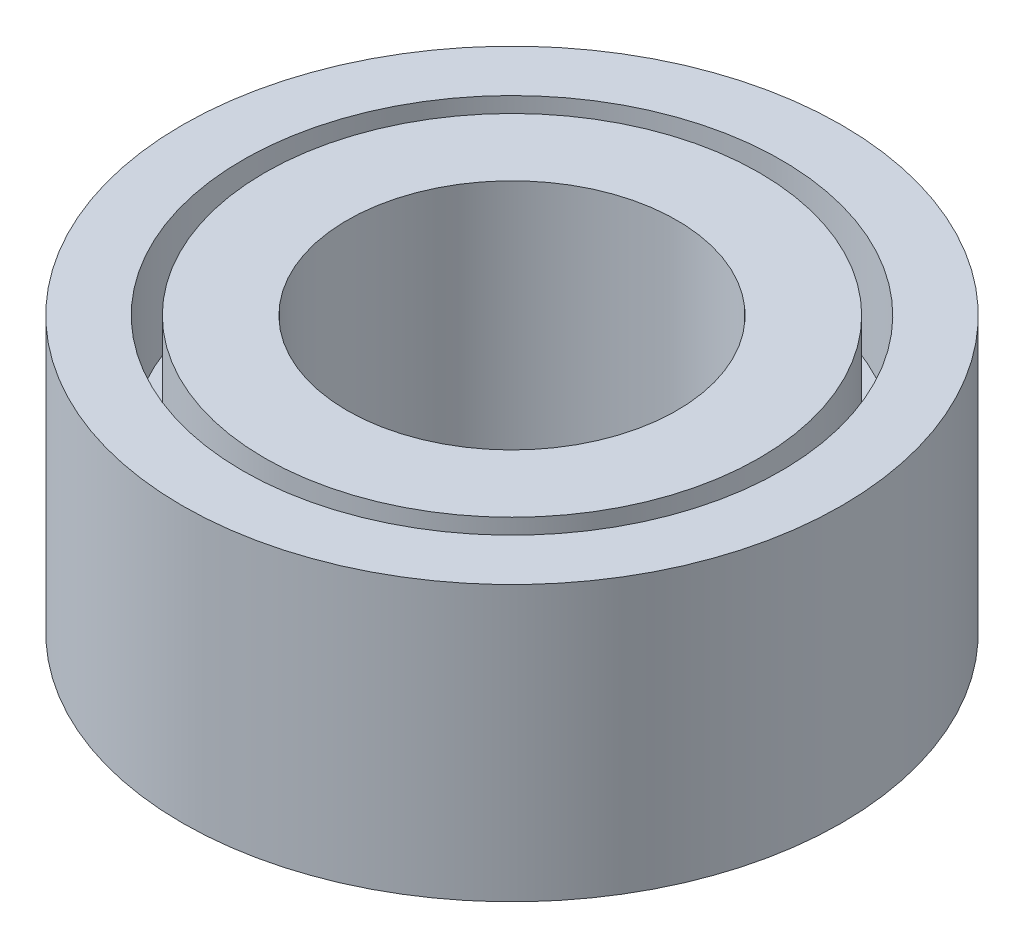
from build123d import *

# Parameters (mm, degrees)
SKETCH_1_R          = 3
SKETCH_1_R_2        = 1.5
EXTRUDE_1_DEPTH     = 2.5
SKETCH_1_3_R        = 2.45
SKETCH_1_3_R_2      = 2.25
CUT_EXTRUDE_1_DEPTH = 1
CUT_EXTRUDE_START   = 1.5
SKETCH_1_4_R        = 2.45
SKETCH_1_4_R_2      = 2.25
CUT_EXTRUDE_2_DEPTH = 1


with BuildPart() as part:
    # 草图1 → 凸台-拉伸1 (new body)
    with BuildSketch(Plane(origin=(0, 0, 0), x_dir=(1, 0, 0), z_dir=(0, 1, 0))):
        with Locations(Location((0, 0, 0), (0, 0, 270))):
            Circle(SKETCH_1_R)
        with Locations(Location((0, 0, 0), (0, 0, 270))):
            Circle(SKETCH_1_R_2, mode=Mode.SUBTRACT)
    extrude(amount=EXTRUDE_1_DEPTH)

    # 草图1<3> → 切除-拉伸-薄壁1 (cut)
    with BuildSketch(Plane(origin=(0, 0, 0), x_dir=(1, 0, 0), z_dir=(0, 1, 0))):
        Circle(SKETCH_1_3_R)
        Circle(SKETCH_1_3_R_2, mode=Mode.SUBTRACT)
    extrude(amount=CUT_EXTRUDE_1_DEPTH, mode=Mode.SUBTRACT)

    # 草图1<4> → 切除-拉伸-薄壁2 (cut)
    with BuildSketch(Plane(origin=(0, 0, 0), x_dir=(1, 0, 0), z_dir=(0, 1, 0)).offset(CUT_EXTRUDE_START)):
        Circle(SKETCH_1_4_R)
        Circle(SKETCH_1_4_R_2, mode=Mode.SUBTRACT)
    extrude(amount=CUT_EXTRUDE_2_DEPTH, mode=Mode.SUBTRACT)


solid = part.part
